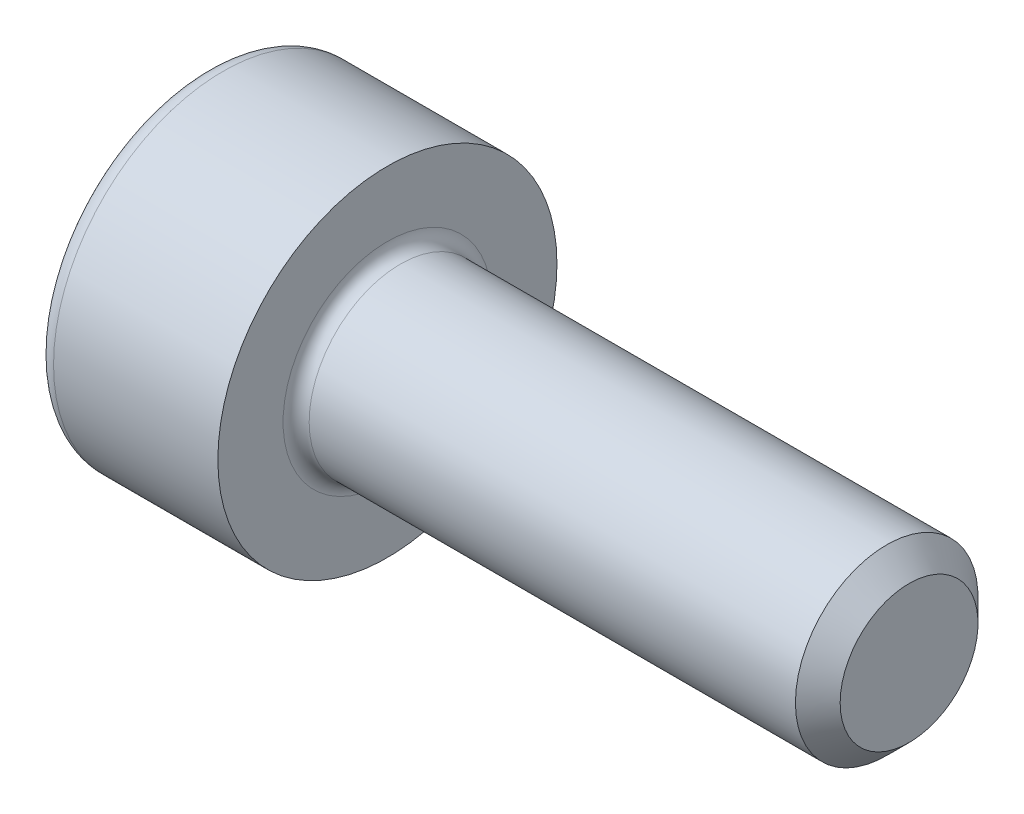
from build123d import *

# Parameters (mm, degrees)
FILLET1_R   = 0.1
FILLET2_R   = 0.14
HEX_2_DEPTH = 0.6


with BuildPart() as part:
    # BodySke → Base-Revolve (revolve)
    with BuildSketch(Plane.XY, mode=Mode.PRIVATE) as base_revolve_sk:
        Polygon((0, 0), (0, 1.3), (1.4, 1.3), (1.4, 0.7), (5.2285, 0.7), (5.4, 0.5285), (5.4, 0), align=None)
    revolve(base_revolve_sk.sketch.rotate(Axis((-31.75, 0, 0), (1, 0, 0)), 90), axis=Axis((-31.75, 0, 0), (1, 0, 0)))

    # Fillet1
    fillet1_edges = [part.edges().sort_by_distance(p)[0] for p in [
        (1.4, 0, -0.7),
    ]]
    fillet(fillet1_edges, radius=FILLET1_R)

    # Fillet2
    fillet2_edges = [part.edges().sort_by_distance(p)[0] for p in [
        (0, 0, -1.3),
    ]]
    fillet(fillet2_edges, radius=FILLET2_R)

    # Sketch2 → Hex-PreBroach (revolve, cut)
    with BuildSketch(Plane.XY, mode=Mode.PRIVATE) as hex_prebroach_sk:
        Polygon((0, 0.66), (0.6, 0.66), (0.981051178, 0), (0, 0), align=None)
    revolve(hex_prebroach_sk.sketch.rotate(Axis((0, 0, 0), (1, 0, 0)), 90), axis=Axis((0, 0, 0), (1, 0, 0)), mode=Mode.SUBTRACT)

    # Sketch3 → Hex 2 (cut)
    with BuildSketch(Plane(origin=(0, 0, 0), x_dir=(0, 0.500000000000001, 0.866025403784438), z_dir=(-1, 0, 0))):
        Polygon((0.381051178, 0.66), (-0.381051178, 0.66), (-0.762102355, 0), (-0.381051178, -0.66), (0.381051178, -0.66), (0.762102355, 0), align=None)
    extrude(amount=-HEX_2_DEPTH, mode=Mode.SUBTRACT)


solid = part.part
